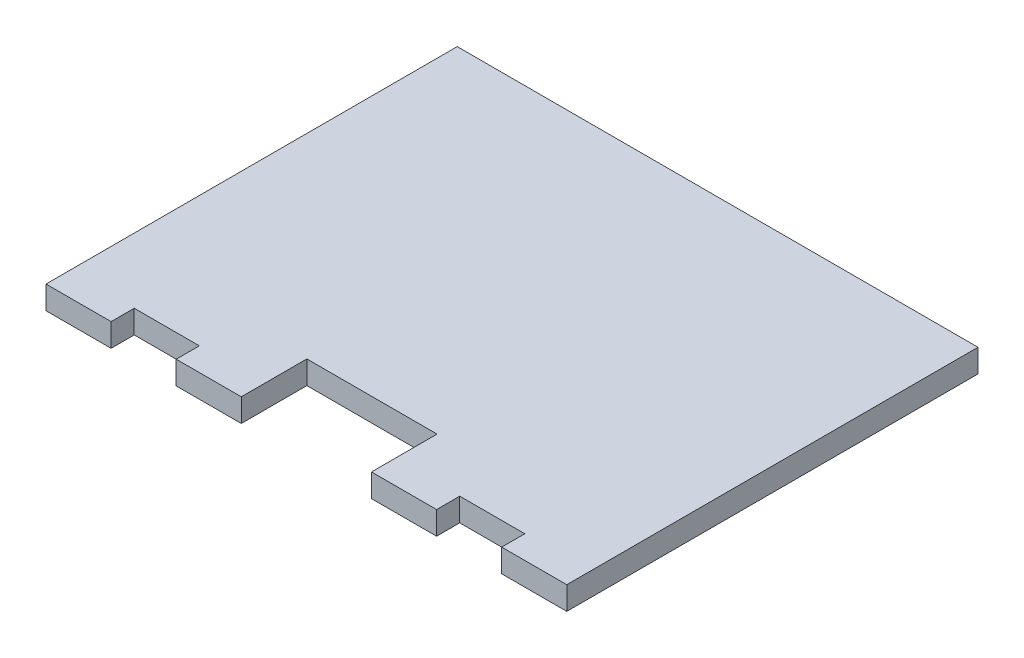
from build123d import *

# Parameters (mm, degrees)
SKETCH1_W           = 257.1877
SKETCH1_H           = 203.09332
BOSS_EXTRUDE1_DEPTH = 11.43
SKETCH2_W           = 32.1484625
SKETCH2_H           = 11.43
SKETCH2_H_2         = 32.385
CUT_EXTRUDE1_DEPTH  = 226.082419081


with BuildPart() as part:
    # Sketch1 → Boss-Extrude1 (new body)
    with BuildSketch(Plane(origin=(0, 0, 0), x_dir=(1, 0, 0), z_dir=(0, 1, 0))):
        with Locations((-29.378826526, -58.378584883)):
            Rectangle(SKETCH1_W, SKETCH1_H)
    extrude(amount=BOSS_EXTRUDE1_DEPTH)

    # Sketch2 → Cut-Extrude1 (cut, through all)
    with BuildSketch(Plane.XZ):
        with Locations((-109.749982776, 154.210244883)):
            Rectangle(SKETCH2_W, SKETCH2_H)
        with Locations((-45.453057776, 143.732744883)):
            Rectangle(SKETCH2_W, SKETCH2_H_2)
        with Locations((-13.304595276, 143.732744883)):
            Rectangle(SKETCH2_W, SKETCH2_H_2)
        with Locations((50.992329724, 154.210244883)):
            Rectangle(SKETCH2_W, SKETCH2_H)
    extrude(amount=-CUT_EXTRUDE1_DEPTH, mode=Mode.SUBTRACT)


solid = part.part
